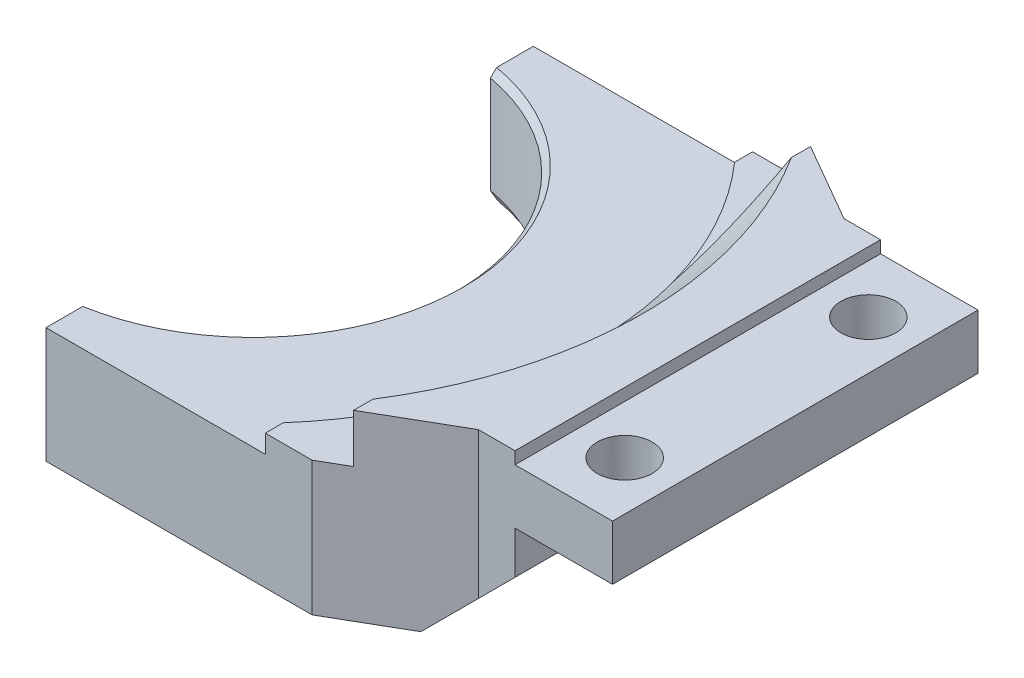
from build123d import *

# Parameters (mm, degrees)
CROQUIS1_R              = 2.25
SALIENTE_EXTRUIR2_DEPTH = 15
CROQUIS2_W              = 8
CROQUIS2_H              = 30
CORTAR_EXTRUIR1_DEPTH   = 1
CROQUIS5_R              = 28
CORTAR_EXTRUIR2_DEPTH   = 5.5
CHAFL_N1_SIZE           = 4
CROQUIS6_W              = 27
CROQUIS6_H              = 4
CORTAR_EXTRUIR3_DEPTH   = 62.686708544
CROQUIS7_W              = 21
CROQUIS7_H              = 1.5
CORTAR_EXTRUIR4_DEPTH   = 62.686708455
CORTAR_EXTRUIR5_REACH   = 60.568
CROQUIS8_W              = 8
CROQUIS8_H              = 9.5
CHAFL_N2_SIZE           = 6
CHAFL_N3_SIZE           = 0.5
CROQUIS9_R              = 3.5
CORTAR_EXTRUIR6_DEPTH   = 42.800119617
CROQUIS10_R             = 4
CORTAR_EXTRUIR7_DEPTH   = 19.5


with BuildPart() as part:
    # Croquis1 → Saliente-Extruir2 (new body)
    with BuildSketch(Plane(origin=(0, 0, 0), x_dir=(1, 0, 0), z_dir=(0, 1, 0))):
        with BuildLine():
            Line((3, 20), (24.839745962, 20))
            Line((24.839745962, 20), (33.5, 15))
            Line((33.5, 15), (44.5, 15))
            Line((44.5, 15), (44.5, -15))
            Line((44.5, -15), (33.5, -15))
            Line((33.5, -15), (24.839745962, -20))
            Line((24.839745962, -20), (3, -20))
            Line((3, -20), (3, -16.479153498))
            ThreePointArc((3, -16.479153498), (16.75, 0), (3, 16.479153498))
            Line((3, 16.479153498), (3, 20))
        make_face()
        with Locations(Location((40.5, 10, 0), (0, 0, 270))):
            Circle(CROQUIS1_R, mode=Mode.SUBTRACT)
        with Locations(Location((40.5, -10, 0), (0, 0, 270))):
            Circle(CROQUIS1_R, mode=Mode.SUBTRACT)
    extrude(amount=SALIENTE_EXTRUIR2_DEPTH)

    # Croquis2 → Cortar-Extruir1 (cut)
    with BuildSketch(Plane(origin=(0, 15, 0), x_dir=(1, 0, 0), z_dir=(0, 1, 0))):
        with Locations((40.5, 0)):
            Rectangle(CROQUIS2_W, CROQUIS2_H)
    extrude(amount=-CORTAR_EXTRUIR1_DEPTH, mode=Mode.SUBTRACT)

    # Croquis3 → Cortar-Revolución1 (revolve, cut)
    with BuildSketch(Plane.XY):
        Polygon((16.75, 0), (16.75, 1), (17.327350269, 0), align=None)
    revolve(axis=Axis((0, 15, 0), (0, -1, 0)), mode=Mode.SUBTRACT)

    # Croquis5 → Cortar-Extruir2 (cut)
    with BuildSketch(Plane(origin=(0, 15, 0), x_dir=(1, 0, 0), z_dir=(0, 1, 0))):
        Circle(CROQUIS5_R)
    extrude(amount=-CORTAR_EXTRUIR2_DEPTH, mode=Mode.SUBTRACT)

    # Chaflán1
    chafl_n1_edges = [part.edges().sort_by_distance(p)[0] for p in [
        (28, 15, 0),
    ]]
    chamfer(chafl_n1_edges, length=CHAFL_N1_SIZE)

    # Croquis6 → Cortar-Extruir3 (cut, through all)
    with BuildSketch(Plane.XY.offset(20)):
        with Locations((13.5, 13)):
            Rectangle(CROQUIS6_W, CROQUIS6_H)
    extrude(amount=-CORTAR_EXTRUIR3_DEPTH, mode=Mode.SUBTRACT)

    # Croquis7 → Cortar-Extruir4 (cut, through all)
    with BuildSketch(Plane.XY.offset(20)):
        with Locations((10.5, 10.25)):
            Rectangle(CROQUIS7_W, CROQUIS7_H)
    extrude(amount=-CORTAR_EXTRUIR4_DEPTH, mode=Mode.SUBTRACT)

    # Croquis8 → Cortar-Extruir5 (cut, up to next)
    with BuildSketch(Plane.XY.offset(15), mode=Mode.PRIVATE) as cortar_extruir5_sk1:
        with Locations((40.5, 4.75)):
            Rectangle(CROQUIS8_W, CROQUIS8_H)
    cortar_extruir5_tool1 = extrude(cortar_extruir5_sk1.sketch, amount=-CORTAR_EXTRUIR5_REACH, mode=Mode.PRIVATE) & part.part
    add(cortar_extruir5_tool1.solids().sort_by_distance((40.5, 4.75, 15))[0], mode=Mode.SUBTRACT)

    # Chaflán2
    chafl_n2_edges = [part.edges().sort_by_distance(p)[0] for p in [
        (36.5, 0, 0),
    ]]
    chamfer(chafl_n2_edges, length=CHAFL_N2_SIZE)

    # Chaflán3
    chafl_n3_edges = [part.edges().sort_by_distance(p)[0] for p in [
        (16.75, 9.5, 0),
    ]]
    chamfer(chafl_n3_edges, length=CHAFL_N3_SIZE)

    # Croquis9 → Cortar-Extruir6 (cut, through all)
    with BuildSketch(Plane(origin=(36.5, 0, 0), x_dir=(0, 0, -1), z_dir=(1, 0, 0))):
        with Locations((0, 5)):
            Circle(CROQUIS9_R)
    extrude(amount=-CORTAR_EXTRUIR6_DEPTH, mode=Mode.SUBTRACT)

    # Croquis10 → Cortar-Extruir7 (cut)
    with BuildSketch(Plane(origin=(36.5, 0, 0), x_dir=(0, 0, -1), z_dir=(1, 0, 0))):
        with Locations((0, 5)):
            Circle(CROQUIS10_R)
    extrude(amount=-CORTAR_EXTRUIR7_DEPTH, mode=Mode.SUBTRACT)


solid = part.part
